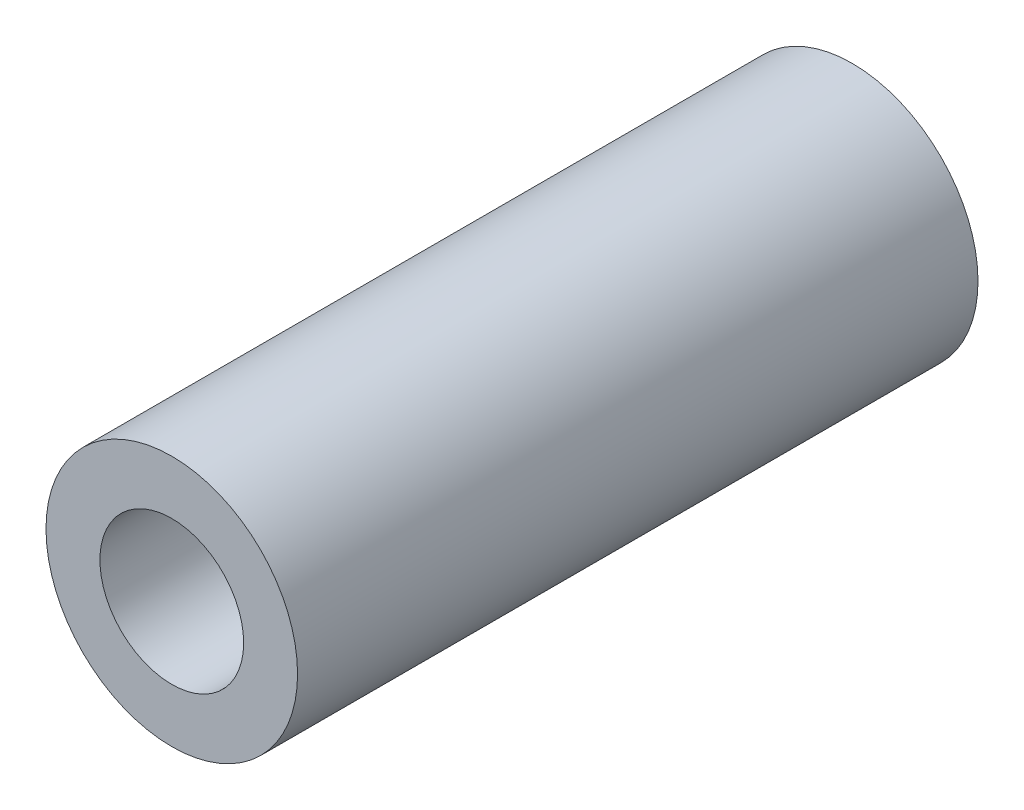
from build123d import *

# Parameters (mm, degrees)
SKETCH1_R           = 10.5
SKETCH1_R_2         = 6
BOSS_EXTRUDE1_DEPTH = 56.8


with BuildPart() as part:
    # Sketch1 → Boss-Extrude1 (new body)
    with BuildSketch(Plane.XY):
        Circle(SKETCH1_R)
        Circle(SKETCH1_R_2, mode=Mode.SUBTRACT)
    extrude(amount=BOSS_EXTRUDE1_DEPTH)


solid = part.part
